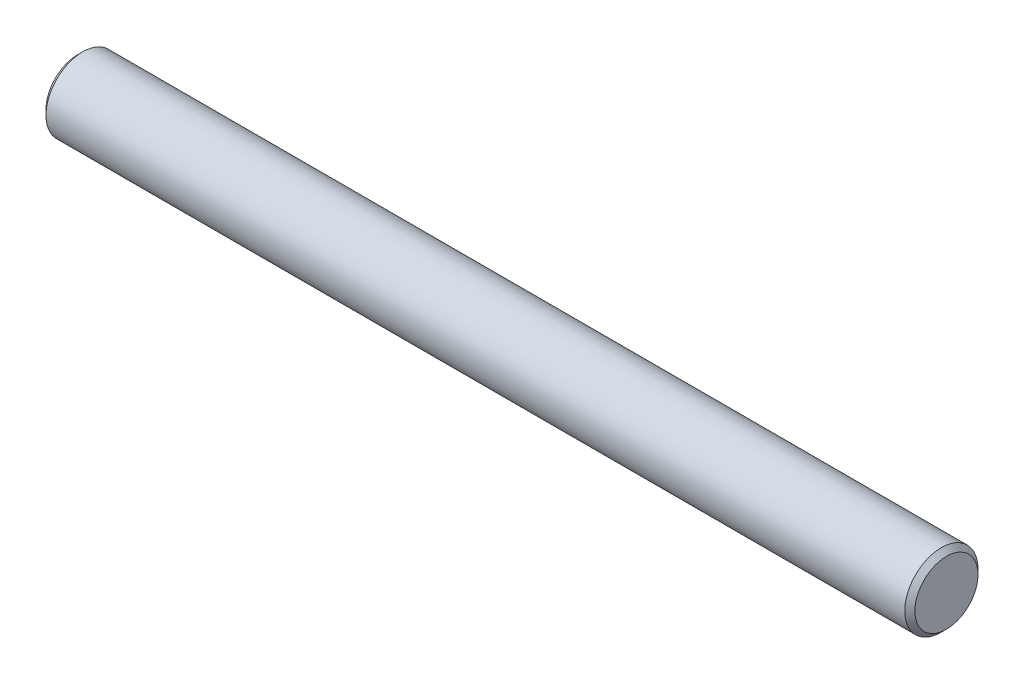
from build123d import *

# Parameters (mm, degrees)
ESQUISSE1_R        = 1.45
BOSS_EXTRU_1_DEPTH = 17.2
CHANFREIN1_SIZE    = 0.2


with BuildPart() as part:
    # Esquisse1 → Boss.-Extru.1 (new, symmetric)
    with BuildSketch(Plane(origin=(0, 0, 0), x_dir=(0, 0, -1), z_dir=(1, 0, 0))):
        with Locations(Location((0, 0, 0), (0, 0, 180))):
            Circle(ESQUISSE1_R)
    extrude(amount=BOSS_EXTRU_1_DEPTH, both=True)

    # Chanfrein1
    chanfrein1_edges = [part.edges().sort_by_distance(p)[0] for p in [
        (-17.2, 0, -1.45),
        (17.2, 0, -1.45),
    ]]
    chamfer(chanfrein1_edges, length=CHANFREIN1_SIZE)


solid = part.part
